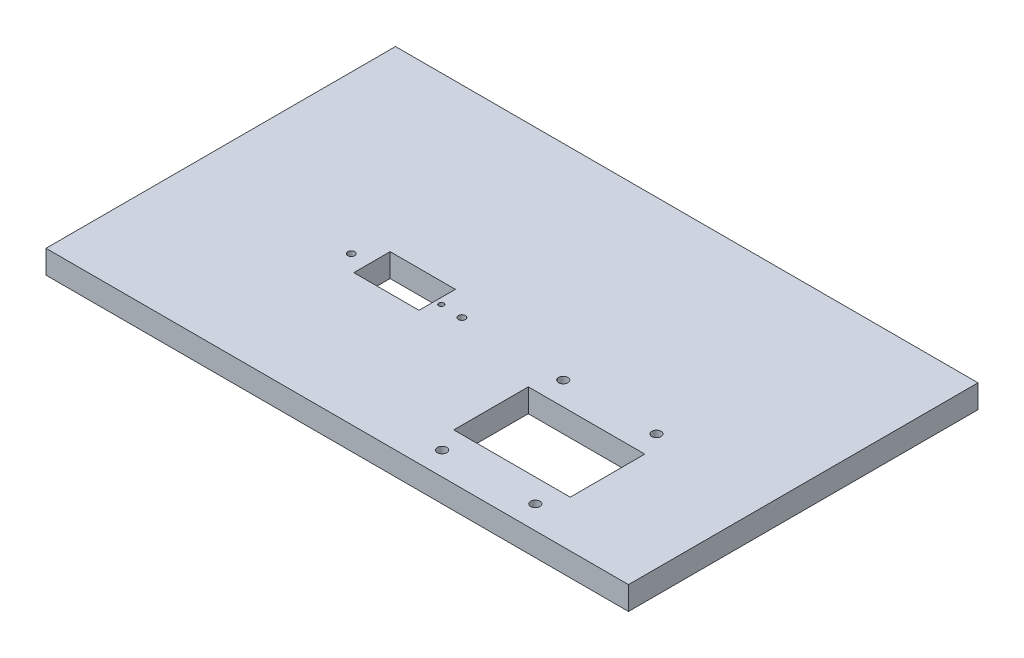
from build123d import *

# Parameters (mm, degrees)
SKETCH2_W           = 250
SKETCH2_H           = 150
BOSS_EXTRUDE1_DEPTH = 10
SKETCH3_R           = 2
SKETCH3_W           = 50
SKETCH3_H           = 32
CUT_EXTRUDE1_DEPTH  = 10
SKETCH4_W           = 28
SKETCH4_H           = 15.597165116
CUT_EXTRUDE2_DEPTH  = 10
SKETCH5_R           = 1.5
SKETCH5_R_2         = 1.1
CUT_EXTRUDE3_DEPTH  = 147.116391962


with BuildPart() as part:
    # Sketch2 → Boss-Extrude1 (new body)
    with BuildSketch(Plane(origin=(0, 0, 0), x_dir=(1, 0, 0), z_dir=(0, 1, 0))):
        Rectangle(SKETCH2_W, SKETCH2_H)
    extrude(amount=BOSS_EXTRUDE1_DEPTH)

    # Sketch3 → Cut-Extrude1 (cut)
    with BuildSketch(Plane(origin=(0, 10, 0), x_dir=(1, 0, 0), z_dir=(0, 1, 0))):
        with Locations(Location((35, -13, 0), (0, 0, 270))):
            Circle(SKETCH3_R)
        with Locations(Location((75, -13, 0), (0, 0, 270))):
            Circle(SKETCH3_R)
        with Locations(Location((35, -65, 0), (0, 0, 270))):
            Circle(SKETCH3_R)
        with Locations(Location((75, -65, 0), (0, 0, 270))):
            Circle(SKETCH3_R)
        with Locations((55, -39)):
            Rectangle(SKETCH3_W, SKETCH3_H)
    extrude(amount=-CUT_EXTRUDE1_DEPTH, mode=Mode.SUBTRACT)

    # Sketch4 → Cut-Extrude2 (cut)
    with BuildSketch(Plane(origin=(0, 10, 0), x_dir=(1, 0, 0), z_dir=(0, 1, 0))):
        with Locations((-35.9, -10.201417442)):
            Rectangle(SKETCH4_W, SKETCH4_H)
    extrude(amount=-CUT_EXTRUDE2_DEPTH, mode=Mode.SUBTRACT)

    # Sketch5 → Cut-Extrude3 (cut, through all)
    with BuildSketch(Plane(origin=(0, 10, 0), x_dir=(1, 0, 0), z_dir=(0, 1, 0))):
        with Locations(Location((-10, -11.5, 0), (0, 0, 270))):
            Circle(SKETCH5_R)
        with Locations(Location((-57.5, -11.5, 0), (0, 0, 270))):
            Circle(SKETCH5_R)
        with Locations(Location((-19.3, -11.05, 0), (0, 0, 270))):
            Circle(SKETCH5_R_2)
    extrude(amount=-CUT_EXTRUDE3_DEPTH, mode=Mode.SUBTRACT)


solid = part.part
